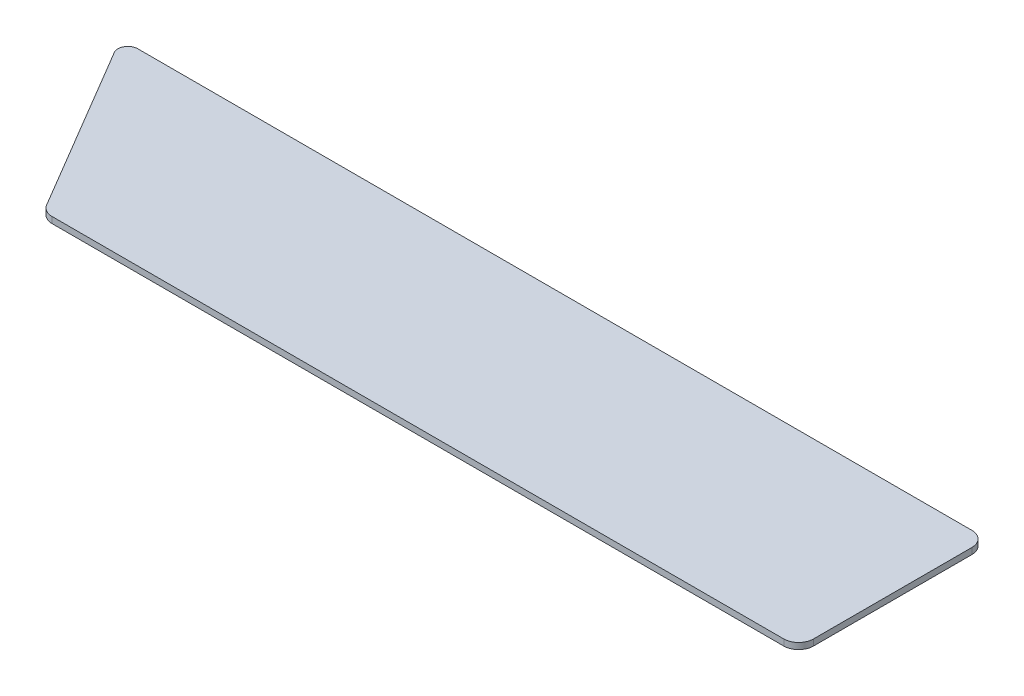
from build123d import *

# Parameters (mm, degrees)
BOSS_EXTRUDE2_DEPTH = 3.175
FILLET3_R           = 7.62
FILLET4_R           = 5.08


with BuildPart() as part:
    # Sketch2 → Boss-Extrude2 (new body)
    with BuildSketch(Plane(origin=(0, 0, 0), x_dir=(1, 0, 0), z_dir=(0, 1, 0))):
        Polygon((444.5, 96.52), (0, 96.52), (57.15, 0), (444.5, 0), align=None)
    extrude(amount=BOSS_EXTRUDE2_DEPTH)

    # Fillet3
    fillet3_edges = [part.edges().sort_by_distance(p)[0] for p in [
        (57.15, 1.5875, 0),
        (444.5, 1.5875, -96.52),
        (444.5, 1.5875, 0),
    ]]
    fillet(fillet3_edges, radius=FILLET3_R)

    # Fillet4
    fillet4_edges = [part.edges().sort_by_distance(p)[0] for p in [
        (0, 1.5875, -96.52),
    ]]
    fillet(fillet4_edges, radius=FILLET4_R)


solid = part.part
